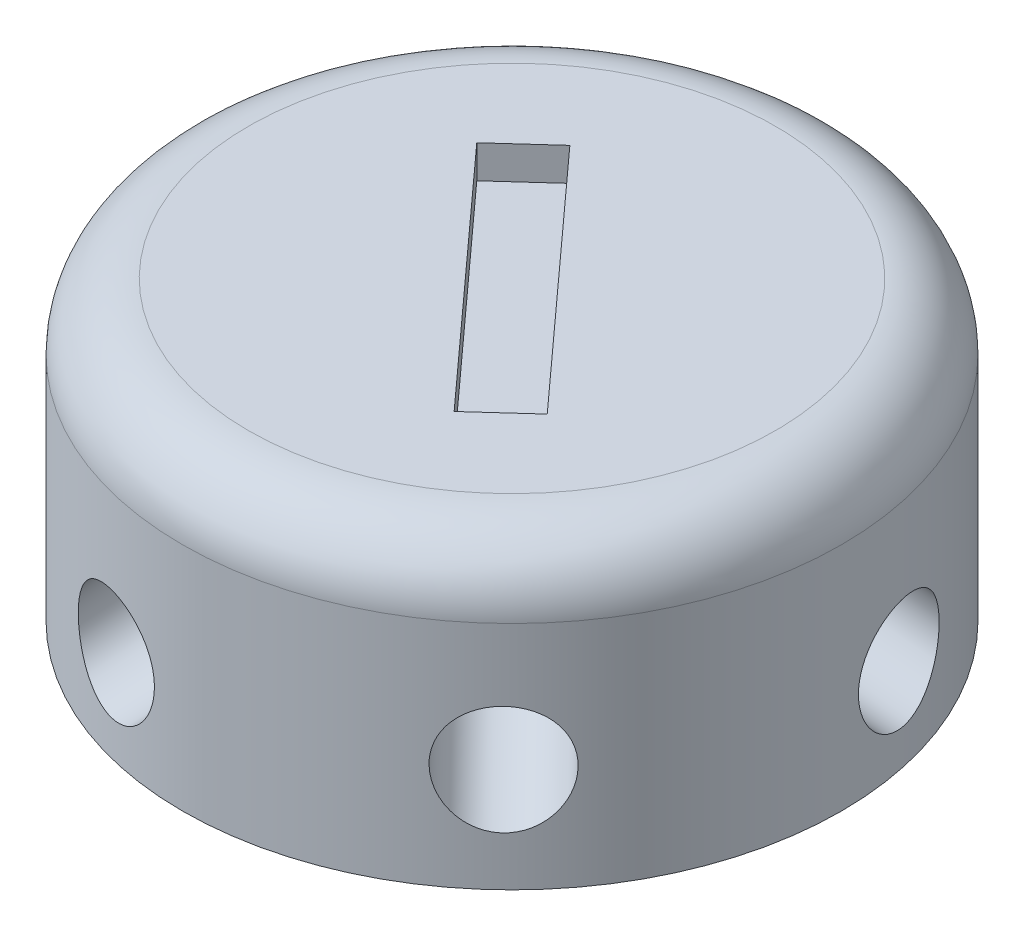
from build123d import *

# Parameters (mm, degrees)
BASE_DEPTH         = 3
BASE_DEPTH_BACK    = 6
SKETCH1_R          = 10
SKETCH2_R          = 1.6
HOLE1_DEPTH        = 19.646604683
HOLE1MIRROR_COUNT  = 2
SKETCH3_R          = 1.6
HOLE2_DEPTH        = 19.158121362
HOLE2MIRROR_COUNT  = 2
SKETCH4_R          = 1.6
HOLE3_DEPTH        = 19.100993715
HOLE3MIRROR_COUNT  = 2
FILLET1_R          = 2
CUT_EXTRUDE1_DEPTH = 1


with BuildPart() as part:
    # Sketch1 → base (new, two sides: drawn at the far end of the back side and taken through both)
    with BuildSketch(Plane(origin=(0, 0, 0), x_dir=(1, 0, 0), z_dir=(0, 1, 0)).offset(-BASE_DEPTH_BACK)):
        Circle(SKETCH1_R)
    extrude(amount=BASE_DEPTH + BASE_DEPTH_BACK)

    # Sketch2 → hole1 (cut, through all)
    with BuildSketch(Plane(origin=(2.670502563, -1.093066116, 2.770130417), x_dir=(-0.6558691872850446, 0.22429081675253856, 0.7207837669443827), z_dir=(-0.6676256406563905, 0.27326652891267483, -0.692532604369038))):
        Circle(SKETCH2_R)
    hole1 = extrude(amount=-HOLE1_DEPTH, mode=Mode.SUBTRACT)

    # hole1mirror: hole1 ×2 about axis
    hole1mirror_axis = Axis((0, 5.5, 0), (0, -1, 0))
    for i in range(1, HOLE1MIRROR_COUNT):
        add(hole1.rotate(hole1mirror_axis, i * 360 / HOLE1MIRROR_COUNT), mode=Mode.SUBTRACT)

    # Sketch3 → hole2 (cut, through all)
    with BuildSketch(Plane(origin=(-0.941672921, -1.236067977, 3.685836142), x_dir=(-0.9718935871364875, 0.07382318789513377, -0.22354639834264944), z_dir=(0.23541823021467095, 0.3090169943749464, -0.921459035481267))):
        Circle(SKETCH3_R)
    hole2 = extrude(amount=-HOLE2_DEPTH, mode=Mode.SUBTRACT)

    # hole2mirror: hole2 ×2 about axis
    hole2mirror_axis = Axis((0, 5.5, 0), (0, -1, 0))
    for i in range(1, HOLE2MIRROR_COUNT):
        add(hole2.rotate(hole2mirror_axis, i * 360 / HOLE2MIRROR_COUNT), mode=Mode.SUBTRACT)

    # Sketch4 → hole3 (cut, through all)
    with BuildSketch(Plane(origin=(-3.717841, -1.236067977, 0.806098168), x_dir=(-0.19123247894507908, -0.06357892752956036, -0.979483465389136), z_dir=(0.9294602499075393, 0.30901699437494623, -0.20152454200243008))):
        Circle(SKETCH4_R)
    hole3 = extrude(amount=-HOLE3_DEPTH, mode=Mode.SUBTRACT)

    # hole3mirror: hole3 ×2 about axis
    hole3mirror_axis = Axis((0, 5.5, 0), (0, -1, 0))
    for i in range(1, HOLE3MIRROR_COUNT):
        add(hole3.rotate(hole3mirror_axis, i * 360 / HOLE3MIRROR_COUNT), mode=Mode.SUBTRACT)

    # Fillet1
    fillet1_edges = [part.edges().sort_by_distance(p)[0] for p in [
        (-10, 3, 0),
    ]]
    fillet(fillet1_edges, radius=FILLET1_R)

    # Sketch6 → Cut-Extrude1 (cut)
    with BuildSketch(Plane(origin=(0, 3, 0), x_dir=(1, 0, 0), z_dir=(0, 1, 0))):
        Polygon((-4.100143947, 3.031306586), (-2.61886111, 4.375107597), (4.100143947, -3.031306586), (2.61886111, -4.375107597), align=None)
    extrude(amount=-CUT_EXTRUDE1_DEPTH, mode=Mode.SUBTRACT)


solid = part.part
